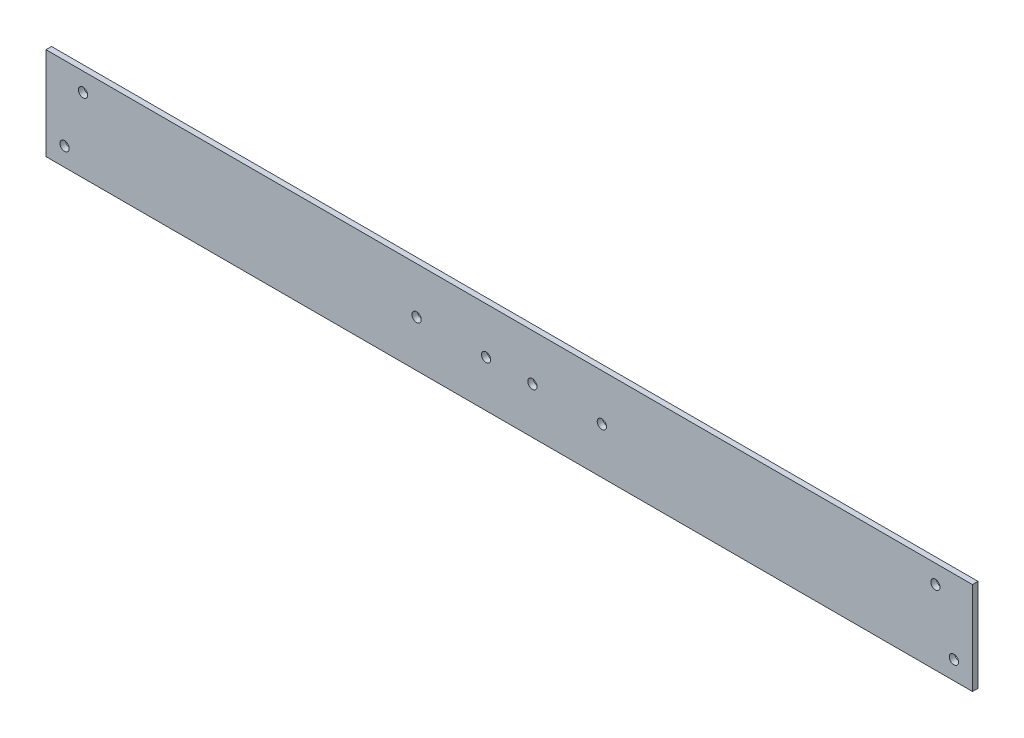
from build123d import *

# Parameters (mm, degrees)
SKETCH1_W           = 500
SKETCH1_H           = 50
SKETCH1_R           = 2.5
BOSS_EXTRUDE1_DEPTH = 3


with BuildPart() as part:
    # Sketch1 → Boss-Extrude1 (new body)
    with BuildSketch(Plane.XY):
        with Locations((250, 25)):
            Rectangle(SKETCH1_W, SKETCH1_H)
        with Locations((20, 40)):
            Circle(SKETCH1_R, mode=Mode.SUBTRACT)
        with Locations((200, 25)):
            Circle(SKETCH1_R, mode=Mode.SUBTRACT)
        with Locations((237.5, 25)):
            Circle(SKETCH1_R, mode=Mode.SUBTRACT)
        with Locations((10, 10)):
            Circle(SKETCH1_R, mode=Mode.SUBTRACT)
        with Locations(Location((262.5, 25, 0), (0, 0, 180))):
            Circle(SKETCH1_R, mode=Mode.SUBTRACT)
        with Locations(Location((300, 25, 0), (0, 0, 180))):
            Circle(SKETCH1_R, mode=Mode.SUBTRACT)
        with Locations(Location((480, 40, 0), (0, 0, 180))):
            Circle(SKETCH1_R, mode=Mode.SUBTRACT)
        with Locations(Location((490, 10, 0), (0, 0, 180))):
            Circle(SKETCH1_R, mode=Mode.SUBTRACT)
    extrude(amount=BOSS_EXTRUDE1_DEPTH)


solid = part.part
